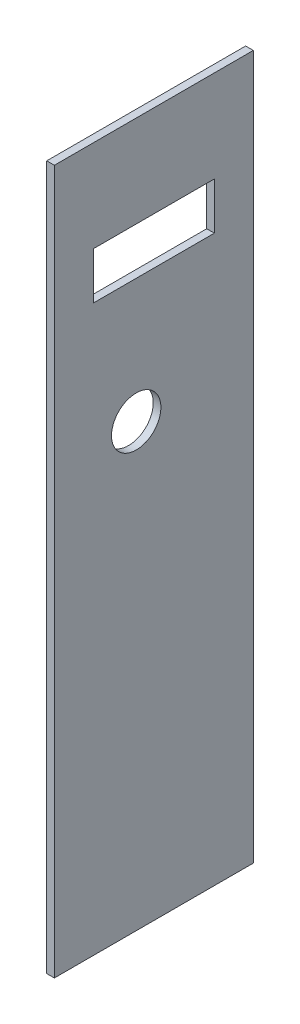
from build123d import *

# Parameters (mm, degrees)
SKETCH1_W           = 82.55
SKETCH1_H           = 292.1
BOSS_EXTRUDE1_DEPTH = 3.175
CUT_EXTRUDE1_REACH  = 305.557
SKETCH2_W           = 50.25
SKETCH2_H           = 19.5
CUT_EXTRUDE2_REACH  = 305.557
SKETCH4_R           = 10.25


with BuildPart() as part:
    # Sketch1 → Boss-Extrude1 (new body)
    with BuildSketch(Plane(origin=(0, 0, 0), x_dir=(0, 0, -1), z_dir=(1, 0, 0))):
        with Locations((41.275, 146.05)):
            Rectangle(SKETCH1_W, SKETCH1_H)
    extrude(amount=BOSS_EXTRUDE1_DEPTH)

    # Sketch2 → Cut-Extrude1 (cut, up to next)
    with BuildSketch(Plane.ZY, mode=Mode.PRIVATE) as cut_extrude1_sk1:
        with Locations((-41.275, 244.25)):
            Rectangle(SKETCH2_W, SKETCH2_H)
    cut_extrude1_tool1 = extrude(cut_extrude1_sk1.sketch, amount=-CUT_EXTRUDE1_REACH, mode=Mode.PRIVATE) & part.part
    add(cut_extrude1_tool1.solids().sort_by_distance((0, 244.25, -41.275))[0], mode=Mode.SUBTRACT)

    # Sketch4 → Cut-Extrude2 (cut, up to next)
    with BuildSketch(Plane.ZY, mode=Mode.PRIVATE) as cut_extrude2_sk1:
        with Locations((-33.963522547, 183.037474176)):
            Circle(SKETCH4_R)
    cut_extrude2_tool1 = extrude(cut_extrude2_sk1.sketch, amount=-CUT_EXTRUDE2_REACH, mode=Mode.PRIVATE) & part.part
    add(cut_extrude2_tool1.solids().sort_by_distance((0, 183.037474, -33.963523))[0], mode=Mode.SUBTRACT)


solid = part.part
